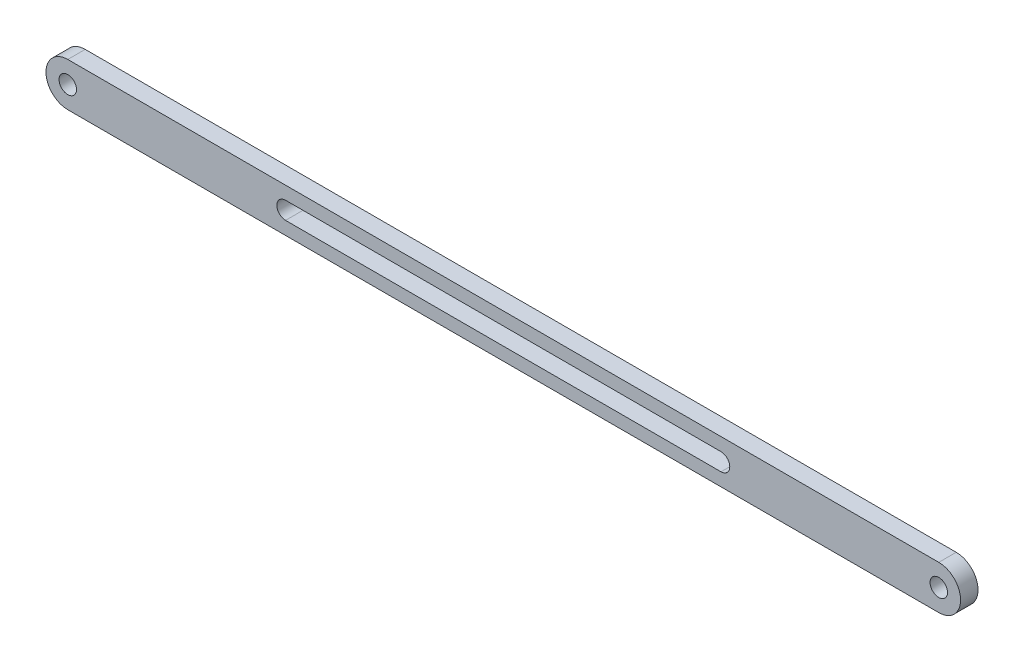
from build123d import *

# Parameters (mm, degrees)
SKETCH1_R           = 2
BOSS_EXTRUDE1_DEPTH = 4


with BuildPart() as part:
    # Sketch1 → Boss-Extrude1 (new body)
    with BuildSketch(Plane.XY):
        with BuildLine():
            Line((0, 5), (200, 5))
            ThreePointArc((200, 5), (205, 0), (200, -5))
            Line((200, -5), (0, -5))
            ThreePointArc((0, -5), (-5, 0), (0, 5))
        make_face()
        Circle(SKETCH1_R, mode=Mode.SUBTRACT)
        with Locations((200, 0)):
            Circle(SKETCH1_R, mode=Mode.SUBTRACT)
        with BuildLine():
            Line((50, 2), (150, 2))
            ThreePointArc((150, 2), (152, 0), (150, -2))
            Line((150, -2), (50, -2))
            ThreePointArc((50, -2), (48, 0), (50, 2))
        make_face(mode=Mode.SUBTRACT)
    extrude(amount=BOSS_EXTRUDE1_DEPTH)


solid = part.part
